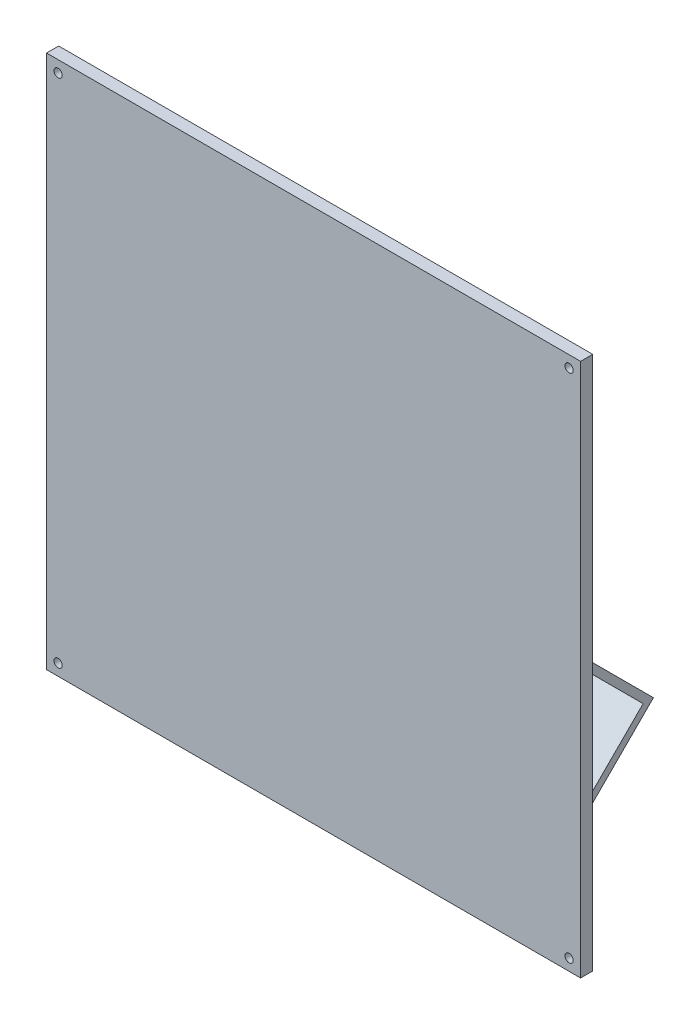
from build123d import *

# Parameters (mm, degrees)
SKICA1_W                                          = 220
SKICA1_H                                          = 220
P_IDAT_VYSUNUT_M1_DEPTH                           = 5
KU_ELOV_ZAHLOUBEN_PRO_M3_ROUBU_SE_Z_P_D           = 3.4
KU_ELOV_ZAHLOUBEN_PRO_M3_ROUBU_SE_Z_P_CSINK_D     = 6.3
KU_ELOV_ZAHLOUBEN_PRO_M3_ROUBU_SE_Z_P_CSINK_ANGLE = 90
ZRCADLIT1_AT_THE_SECOND_PLANE_COPY_1_D            = 3.4
ZRCADLIT1_AT_THE_SECOND_PLANE_COPY_1_CSINK_D      = 6.3
ZRCADLIT1_AT_THE_SECOND_PLANE_COPY_1_CSINK_ANGLE  = 90
SKICA11_W                                         = 160
SKICA11_H                                         = 77.7817
P_IDAT_VYSUNUT_M2_DEPTH                           = 3
SKICA17_W                                         = 160
SKICA17_H                                         = 77.781745931
P_IDAT_VYSUNUT_M3_DEPTH                           = 3


with BuildPart() as part:
    # Skica1 → Přidat vysunutím1 (new body)
    with BuildSketch(Plane.XY):
        Rectangle(SKICA1_W, SKICA1_H)
    extrude(amount=P_IDAT_VYSUNUT_M1_DEPTH)

    # Kuželové zahloubení pro M3 šroubu se zápustnou hlavou plochou1 (through all)
    with Locations(Plane(origin=(0, 0, 0), x_dir=(-1, 0, 0), z_dir=(0, 0, -1))):
        with Locations((-105.25, -105.25)):
            ku_elov_zahlouben_pro_m3_roubu_se_z_p = CounterSinkHole(KU_ELOV_ZAHLOUBEN_PRO_M3_ROUBU_SE_Z_P_D / 2, KU_ELOV_ZAHLOUBEN_PRO_M3_ROUBU_SE_Z_P_CSINK_D / 2, counter_sink_angle=KU_ELOV_ZAHLOUBEN_PRO_M3_ROUBU_SE_Z_P_CSINK_ANGLE)

    # Zrcadlit1: Kuželové zahloubení pro M3 šroubu se zápustnou hlavou plochou1 across plane
    add(ku_elov_zahlouben_pro_m3_roubu_se_z_p.mirror(Plane.ZX), mode=Mode.SUBTRACT)

    # Zrcadlit1 at the second plane: Kuželové zahloubení pro M3 šroubu se zápustnou hlavou plochou1 across plane
    add(ku_elov_zahlouben_pro_m3_roubu_se_z_p.mirror(Plane(origin=(0, 0, 0), x_dir=(0, 0, 1), z_dir=(1, 0, 0))), mode=Mode.SUBTRACT)

    # Zrcadlit1 at the second plane copy 1 (through all)
    with Locations(Plane(origin=(0, 0, 0), x_dir=(1, 0, 0), z_dir=(0, 0, -1))):
        with Locations((-105.25, -105.25)):
            CounterSinkHole(ZRCADLIT1_AT_THE_SECOND_PLANE_COPY_1_D / 2, ZRCADLIT1_AT_THE_SECOND_PLANE_COPY_1_CSINK_D / 2, counter_sink_angle=ZRCADLIT1_AT_THE_SECOND_PLANE_COPY_1_CSINK_ANGLE)

    # Skica11 → Přidat vysunutím2 (add)
    with BuildSketch(Plane(origin=(0, 0, 0), x_dir=(-1, 0, 0), z_dir=(0, -0.7071067811865438, 0.7071067811865512))):
        with Locations((0, 38.89085)):
            Rectangle(SKICA11_W, SKICA11_H)
    extrude(amount=P_IDAT_VYSUNUT_M2_DEPTH)

    # Skica17 → Přidat vysunutím3 (add)
    with BuildSketch(Plane(origin=(0, -54.999967522, -54.999967522), x_dir=(1, 0, 0), z_dir=(0, -0.7071067811865513, -0.7071067811865438))):
        with Locations((0, 38.890872966)):
            Rectangle(SKICA17_W, SKICA17_H)
    extrude(amount=-P_IDAT_VYSUNUT_M3_DEPTH)


solid = part.part
